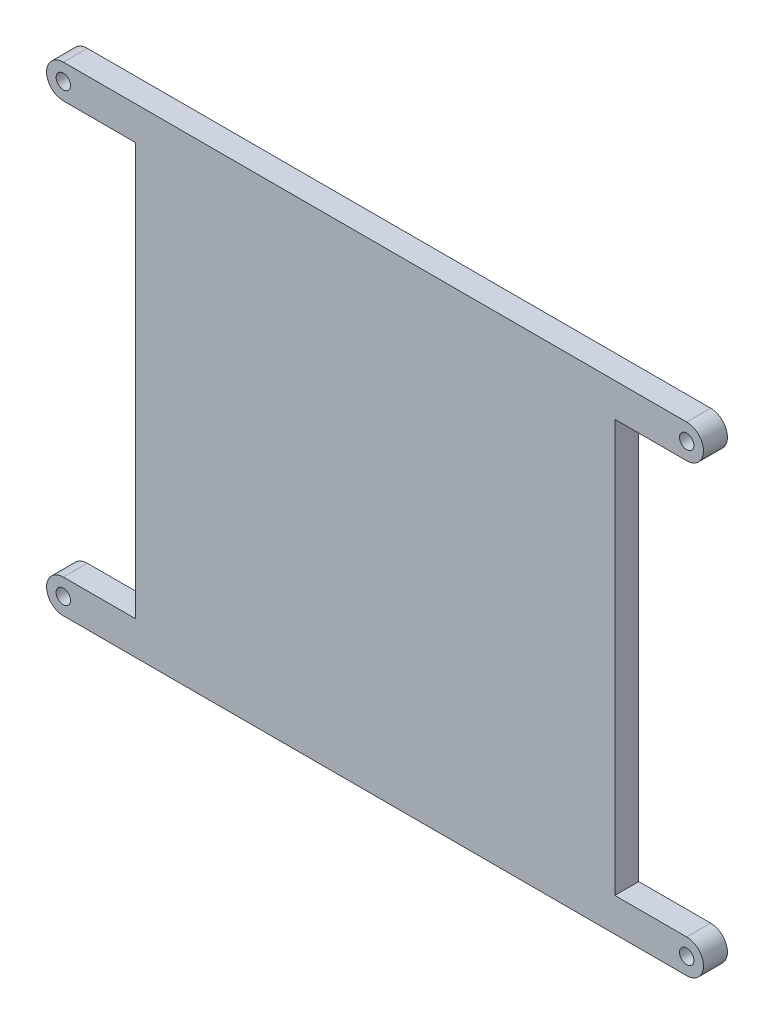
from build123d import *

# Parameters (mm, degrees)
ESQUISSE1_R        = 1.5
BOSS_EXTRU_1_DEPTH = 5


with BuildPart() as part:
    # Esquisse1 → Boss.-Extru.1 (new body)
    with BuildSketch(Plane.XY):
        with BuildLine():
            Line((-65, -43), (-50, -43))
            Line((-50, -43), (-50, 43))
            Line((-50, 43), (-65, 43))
            ThreePointArc((-65, 43), (-68.5, 46.5), (-65, 50))
            Line((-65, 50), (-50, 50))
            Line((-50, 50), (50, 50))
            Line((50, 50), (65, 50))
            ThreePointArc((65, 50), (68.5, 46.5), (65, 43))
            Line((65, 43), (50, 43))
            Line((50, 43), (50, -43))
            Line((50, -43), (65, -43))
            ThreePointArc((65, -43), (68.5, -46.5), (65, -50))
            Line((65, -50), (50, -50))
            Line((50, -50), (-50, -50))
            Line((-50, -50), (-65, -50))
            ThreePointArc((-65, -50), (-68.5, -46.5), (-65, -43))
        make_face()
        with Locations((-65, 46.5)):
            Circle(ESQUISSE1_R, mode=Mode.SUBTRACT)
        with Locations((65, 46.5)):
            Circle(ESQUISSE1_R, mode=Mode.SUBTRACT)
        with Locations((65, -46.5)):
            Circle(ESQUISSE1_R, mode=Mode.SUBTRACT)
        with Locations((-65, -46.5)):
            Circle(ESQUISSE1_R, mode=Mode.SUBTRACT)
    extrude(amount=BOSS_EXTRU_1_DEPTH)


solid = part.part
